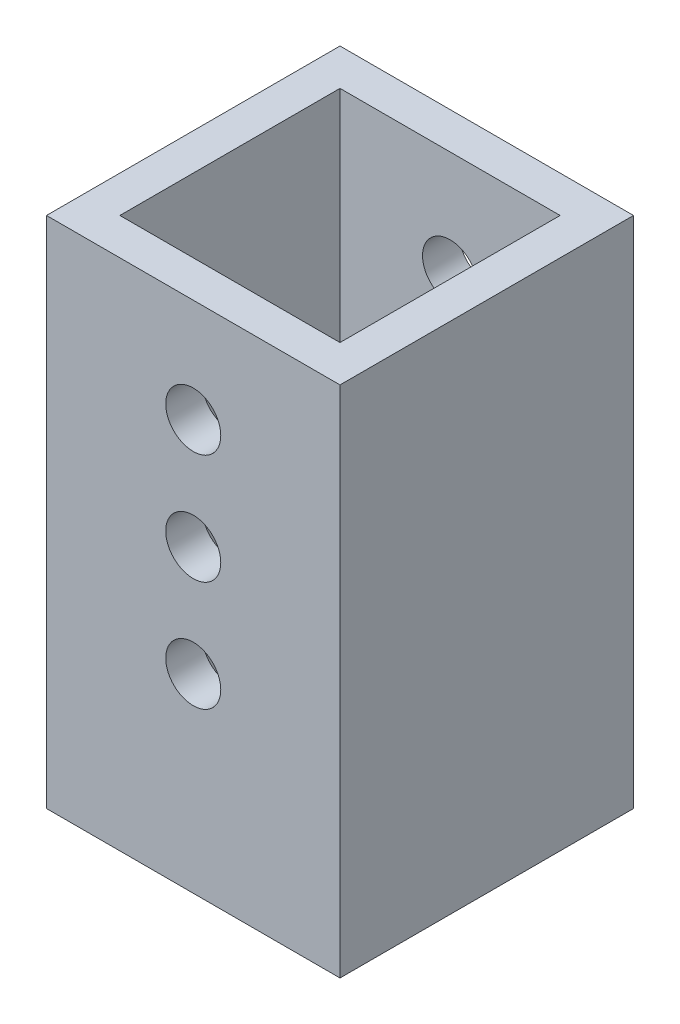
from build123d import *

# Parameters (mm, degrees)
SKETCH1_W           = 50.8
SKETCH1_H           = 50.8
BOSS_EXTRUDE1_DEPTH = 88.9
SKETCH2_W           = 38.1
SKETCH2_H           = 38.1
CUT_EXTRUDE1_DEPTH  = 96.882897328
SKETCH3_W           = 38.1
SKETCH3_H           = 38.1
BOSS_EXTRUDE2_DEPTH = 7.62
SKETCH4_R           = 6.35
BOSS_EXTRUDE3_DEPTH = 19.05
SKETCH6_R           = 4.7625
CUT_EXTRUDE2_DEPTH  = 106.494123059


with BuildPart() as part:
    # Sketch1 → Boss-Extrude1 (new body)
    with BuildSketch(Plane(origin=(0, 0, 0), x_dir=(1, 0, 0), z_dir=(0, 1, 0))):
        Rectangle(SKETCH1_W, SKETCH1_H)
    extrude(amount=BOSS_EXTRUDE1_DEPTH)

    # Sketch2 → Cut-Extrude1 (cut, through all)
    with BuildSketch(Plane(origin=(0, 88.9, 0), x_dir=(1, 0, 0), z_dir=(0, 1, 0))):
        Rectangle(SKETCH2_W, SKETCH2_H)
    extrude(amount=-CUT_EXTRUDE1_DEPTH, mode=Mode.SUBTRACT)

    # Sketch3 → Boss-Extrude2 (add)
    with BuildSketch(Plane(origin=(0, 0, 0), x_dir=(-1, 0, 0), z_dir=(0, -1, 0))):
        Rectangle(SKETCH3_W, SKETCH3_H)
    extrude(amount=-BOSS_EXTRUDE2_DEPTH)

    # Sketch4 → Boss-Extrude3 (add)
    with BuildSketch(Plane(origin=(0, 0, 0), x_dir=(-1, 0, 0), z_dir=(0, -1, 0))):
        with Locations(Location((0, 0, 0), (0, 0, 270))):
            Circle(SKETCH4_R)
    extrude(amount=BOSS_EXTRUDE3_DEPTH)

    # Sketch6 → Cut-Extrude2 (cut, through all)
    with BuildSketch(Plane.XY.offset(25.4)):
        with Locations((0, 70.977272932)):
            Circle(SKETCH6_R)
        with Locations((0, 51.927272932)):
            Circle(SKETCH6_R)
        with Locations((0, 32.877272932)):
            Circle(SKETCH6_R)
    extrude(amount=-CUT_EXTRUDE2_DEPTH, mode=Mode.SUBTRACT)


solid = part.part
